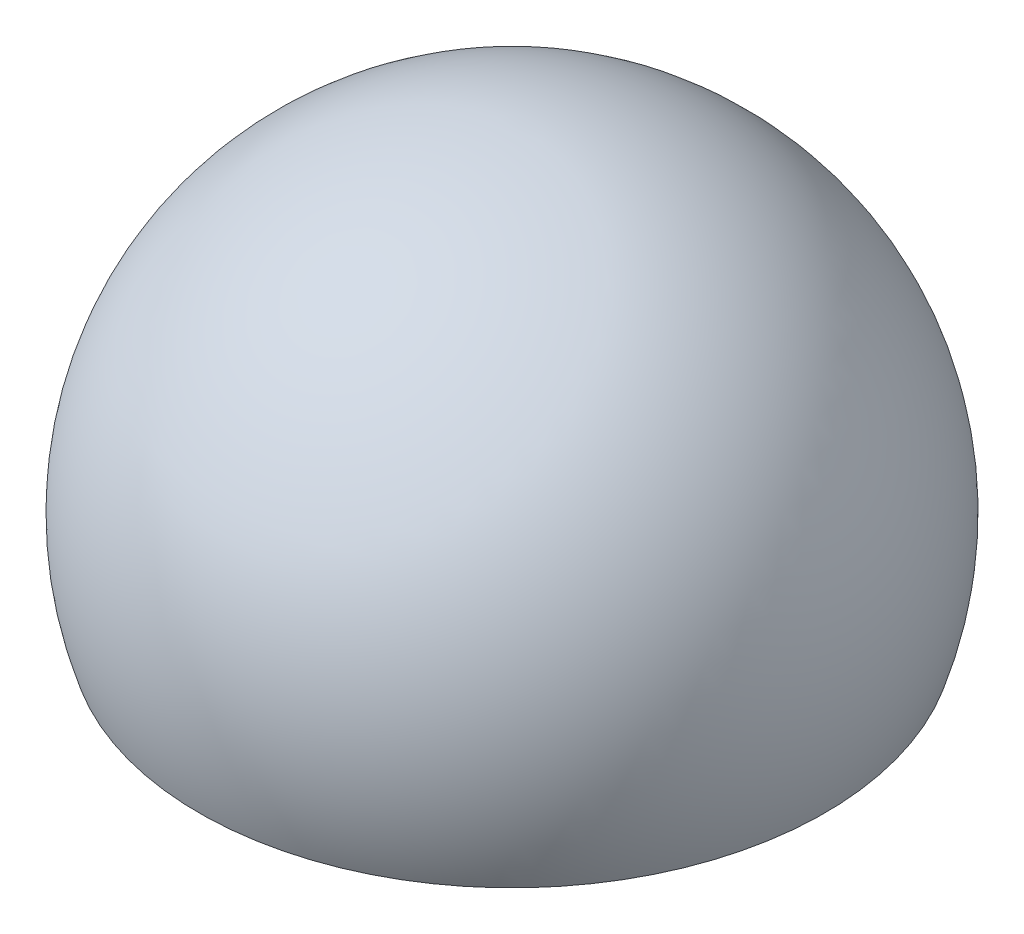
from build123d import *

# Parameters (mm, degrees)
SKETCH6_W          = 61.139548952
SKETCH6_H          = 56.128506874
CUT_EXTRUDE7_DEPTH = 5
SKETCH7_W          = 5
SKETCH7_H          = 10
CUT_EXTRUDE8_DEPTH = 10


with BuildPart() as part:
    # Sketch1 → Revolve1 (revolve)
    with BuildSketch(Plane.XY):
        with BuildLine():
            Line((0, 37.888888889), (0, -12.111111111))
            ThreePointArc((0, -12.111111111), (-25, 12.888888889), (0, 37.888888889))
        make_face()
    revolve(axis=Axis((0, 37.888888889, 0), (0, -1, 0)))

    # Sketch6 → Cut-Extrude7 (cut, symmetric)
    with BuildSketch(Plane(origin=(0, 0, 0), x_dir=(1, 0, 0), z_dir=(0, 1, 0))):
        Rectangle(SKETCH6_W, SKETCH6_H)
    extrude(amount=CUT_EXTRUDE7_DEPTH, both=True, mode=Mode.SUBTRACT)


with BuildPart() as body_2:
    # of the pieces the cut leaves, the one that is kept (cut_extrude7_keep)
    add(part.part.solids().sort_by_distance((-23.722677591, 5, 0))[0])

    # Sketch7 → Cut-Extrude8 (cut)
    with BuildSketch(Plane(origin=(0, 0, 0), x_dir=(1, 0, 0), z_dir=(0, 1, 0))):
        Rectangle(SKETCH7_W, SKETCH7_H)
    extrude(amount=CUT_EXTRUDE8_DEPTH, mode=Mode.SUBTRACT)


solid = body_2.part
